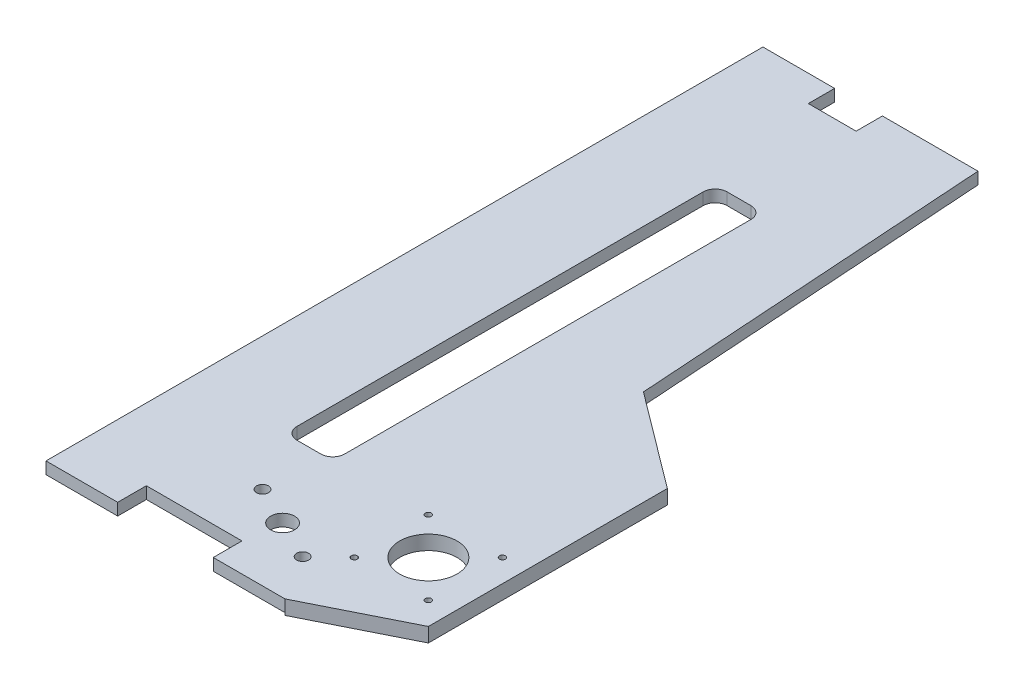
from build123d import *

# Parameters (mm, degrees)
BOSS_EXTRUDE1_DEPTH = 5
SKETCH2_R           = 5
SKETCH2_R_2         = 2.5
CUT_EXTRUDE1_DEPTH  = 6
SKETCH4_W           = 20
SKETCH4_H           = 11
CUT_EXTRUDE3_DEPTH  = 10
BOSS_EXTRUDE3_DEPTH = 6
SKETCH7_R           = 1.25
SKETCH7_R_2         = 12
CUT_EXTRUDE4_DEPTH  = 6
SKETCH9_W           = 20
SKETCH9_H           = 180
CUT_EXTRUDE5_DEPTH  = 6
FILLET1_R           = 5


with BuildPart() as part:
    # Sketch1 → Boss-Extrude1 (new body)
    with BuildSketch(Plane(origin=(0, 0, 0), x_dir=(1, 0, 0), z_dir=(0, 1, 0))):
        Polygon((0, 0), (30, 0), (30, 12), (70, 12), (70, 0), (100, 0), (100, 300), (0, 300), align=None)
    extrude(amount=BOSS_EXTRUDE1_DEPTH)

    # Sketch2 → Cut-Extrude1 (cut)
    with BuildSketch(Plane(origin=(0, 5, 0), x_dir=(1, 0, 0), z_dir=(0, 1, 0))):
        with Locations(Location((72, 27, 0), (0, 0, 270))):
            Circle(SKETCH2_R)
        with Locations(Location((88.403124702, 19, 0), (0, 0, 270))):
            Circle(SKETCH2_R_2)
        with Locations(Location((55.596875298, 35, 0), (0, 0, 270))):
            Circle(SKETCH2_R_2)
    extrude(amount=-CUT_EXTRUDE1_DEPTH, mode=Mode.SUBTRACT)

    # Sketch4 → Cut-Extrude3 (cut)
    with BuildSketch(Plane(origin=(0, 5, 0), x_dir=(1, 0, 0), z_dir=(0, 1, 0))):
        with Locations((40, 294.5)):
            Rectangle(SKETCH4_W, SKETCH4_H)
    extrude(amount=-CUT_EXTRUDE3_DEPTH, mode=Mode.SUBTRACT)

    # Sketch6 → Boss-Extrude3 (add)
    with BuildSketch(Plane(origin=(0, 5, 0), x_dir=(1, 0, 0), z_dir=(0, 1, 0))):
        Polygon((100, 0), (100, 150), (140, 120), (140, 20), align=None)
    extrude(amount=-BOSS_EXTRUDE3_DEPTH)

    # Sketch7 → Cut-Extrude4 (cut)
    with BuildSketch(Plane(origin=(0, 5, 0), x_dir=(1, 0, 0), z_dir=(0, 1, 0))):
        with Locations(Location((130.5, 60.5, 0), (0, 0, 270))):
            Circle(SKETCH7_R)
        with Locations(Location((99.5, 60.5, 0), (0, 0, 270))):
            Circle(SKETCH7_R)
        with Locations(Location((99.5, 29.5, 0), (0, 0, 270))):
            Circle(SKETCH7_R)
        with Locations(Location((130.5, 29.5, 0), (0, 0, 270))):
            Circle(SKETCH7_R)
        with Locations(Location((115, 45, 0), (0, 0, 270))):
            Circle(SKETCH7_R_2)
    extrude(amount=-CUT_EXTRUDE4_DEPTH, mode=Mode.SUBTRACT)

    # Sketch9 → Cut-Extrude5 (cut)
    with BuildSketch(Plane(origin=(0, 5, 0), x_dir=(1, 0, 0), z_dir=(0, 1, 0))):
        Polygon((100, 300), (90, 300), (100, 150), align=None)
        with Locations((50, 150)):
            Rectangle(SKETCH9_W, SKETCH9_H)
    extrude(amount=-CUT_EXTRUDE5_DEPTH, mode=Mode.SUBTRACT)

    # Fillet1
    fillet1_edges = [part.edges().sort_by_distance(p)[0] for p in [
        (60, 2.5, -240),
        (60, 2.5, -60),
        (40, 2.5, -60),
        (40, 2.5, -240),
    ]]
    fillet(fillet1_edges, radius=FILLET1_R)


solid = part.part
